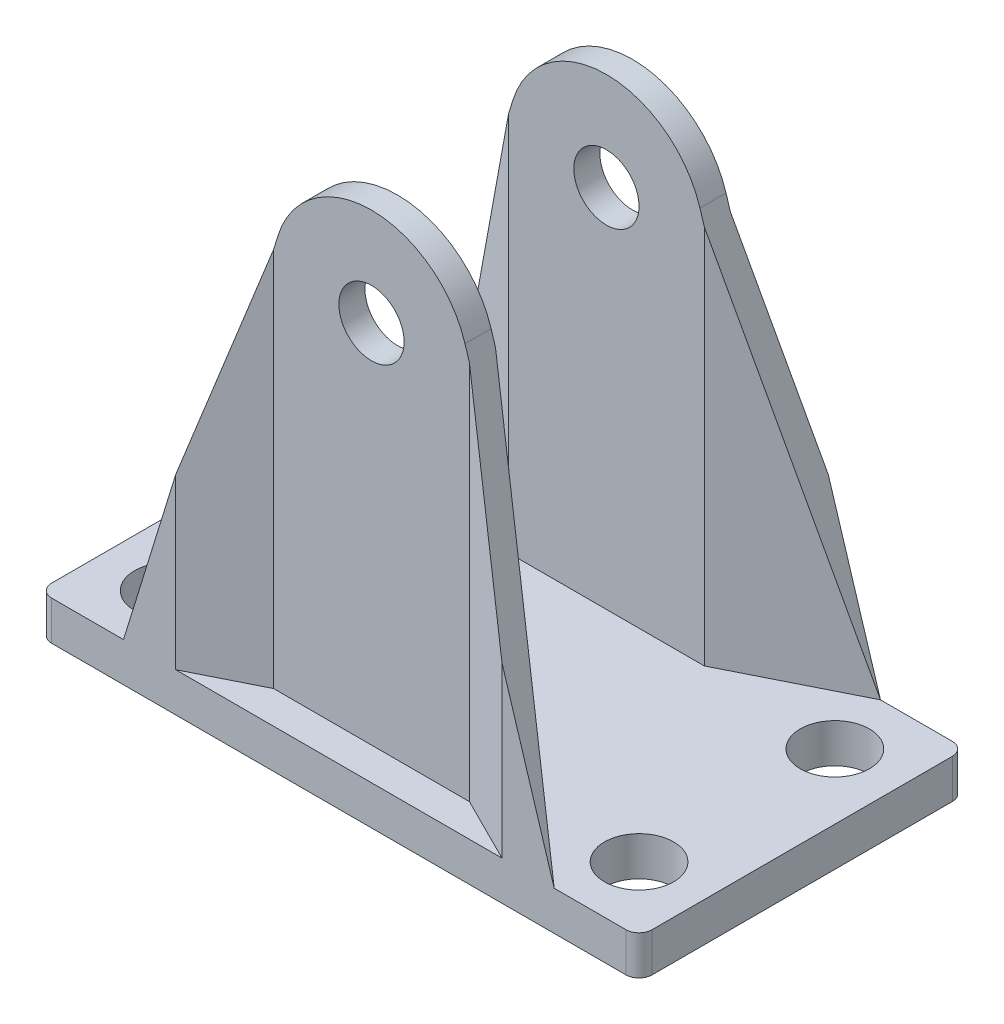
from build123d import *

# Parameters (mm, degrees)
SKETCH_1_W          = 46
SKETCH_1_H          = 25
SKETCH_1_R          = 2.65
EXTRUDE_1_DEPTH     = 1.5
FILLET_1_R          = 1
SKETCH_2_W          = 15
SKETCH_2_H          = 2
EXTRUDE_2_DEPTH     = 50
CUT_EXTRUDE_1_DEPTH = 25
SKETCH_4_R          = 2.5
CUT_EXTRUDE_2_DEPTH = 25


with BuildPart() as part:
    # ｽｹｯﾁ1 → ﾎﾞｽ - 押し出し1 (new, symmetric)
    with BuildSketch(Plane(origin=(0, 0, 0), x_dir=(1, 0, 0), z_dir=(0, 1, 0))):
        Rectangle(SKETCH_1_W, SKETCH_1_H)
        with Locations(Location((-18, 7.5, 0), (0, 0, 270))):
            Circle(SKETCH_1_R, mode=Mode.SUBTRACT)
        with Locations(Location((18, 7.5, 0), (0, 0, 270))):
            Circle(SKETCH_1_R, mode=Mode.SUBTRACT)
        with Locations(Location((-18, -7.5, 0), (0, 0, 270))):
            Circle(SKETCH_1_R, mode=Mode.SUBTRACT)
        with Locations(Location((18, -7.5, 0), (0, 0, 270))):
            Circle(SKETCH_1_R, mode=Mode.SUBTRACT)
    extrude(amount=EXTRUDE_1_DEPTH, both=True)

    # ﾌｨﾚｯﾄ1
    fillet_1_edges = [part.edges().sort_by_distance(p)[0] for p in [
        (23, 0, 12.5),
        (-23, 0, 12.5),
        (-23, 0, -12.5),
        (23, 0, -12.5),
    ]]
    fillet(fillet_1_edges, radius=FILLET_1_R)

    # ｽｹｯﾁ2 → ﾎﾞｽ - 押し出し2 (add)
    with BuildSketch(Plane(origin=(0, 1.5, 0), x_dir=(1, 0, 0), z_dir=(0, 1, 0))):
        Polygon((-7.5, 8), (-7.5, 10), (-12.5, 12.5), (-16.5, 12.5), align=None)
        with Locations((0, 9)):
            Rectangle(SKETCH_2_W, SKETCH_2_H)
        Polygon((12.5, 12.5), (7.5, 10), (7.5, 8), (16.5, 12.5), align=None)
    extrude_2 = extrude(amount=EXTRUDE_2_DEPTH)

    # ﾐﾗｰ1: ﾎﾞｽ - 押し出し2 across plane
    add(extrude_2.mirror(Plane.XY))

    # ｽｹｯﾁ3 → ｶｯﾄ - 押し出し1 (cut, symmetric)
    with BuildSketch(Plane.XY):
        Polygon((7.5, 30.632117688), (16.5, 1.5), (16.5, 51.5), (12.5, 51.5), (7.5, 51.5), align=None)
        with BuildLine():
            Line((-7.5, 51.5), (-7.5, 30.632117688))
            Line((-7.5, 30.632117688), (-7.165830141, 31.713792762))
            ThreePointArc((-7.165830141, 31.713792762), (0, 37), (7.165830141, 31.713792762))
            Line((7.165830141, 31.713792762), (7.5, 30.632117688))
            Line((7.5, 30.632117688), (7.5, 51.5))
            Line((7.5, 51.5), (-7.5, 51.5))
        make_face()
        Polygon((-16.5, 51.5), (-16.5, 1.5), (-7.5, 30.632117688), (-7.5, 51.5), (-12.5, 51.5), align=None)
    extrude(amount=CUT_EXTRUDE_1_DEPTH, both=True, mode=Mode.SUBTRACT)

    # ｽｹｯﾁ4 → ｶｯﾄ - 押し出し2 (cut, symmetric)
    with BuildSketch(Plane(origin=(0, 0, -10), x_dir=(-1, 0, 0), z_dir=(0, 0, -1))):
        with Locations((0, 29.5)):
            Circle(SKETCH_4_R)
    extrude(amount=CUT_EXTRUDE_2_DEPTH, both=True, mode=Mode.SUBTRACT)


solid = part.part
